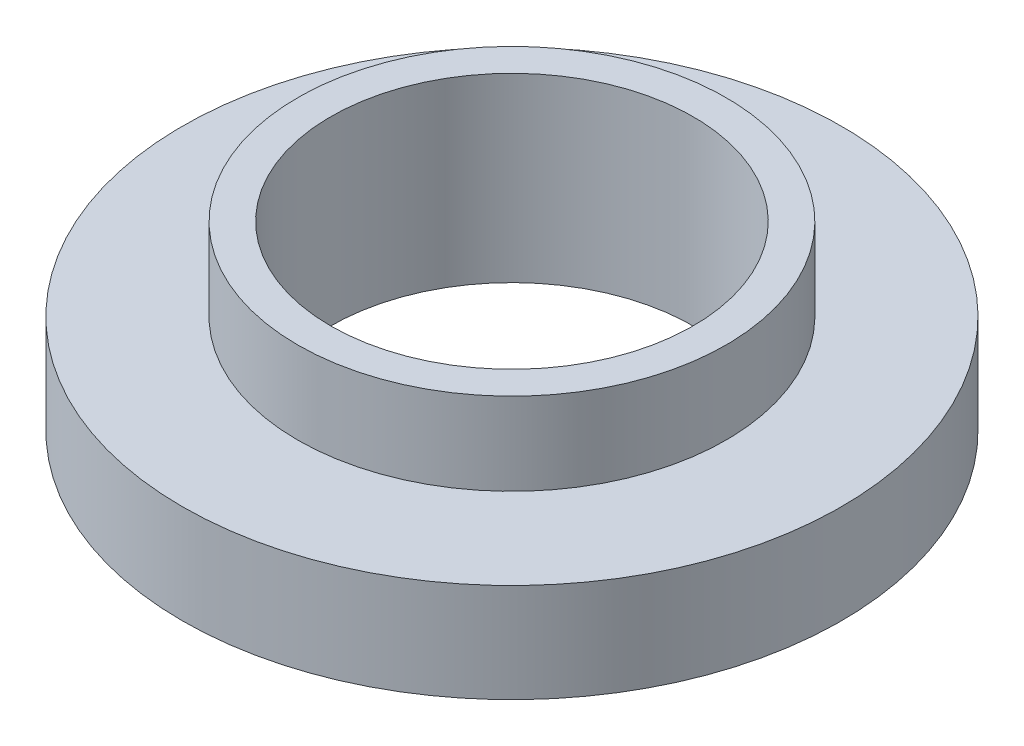
from build123d import *

# Parameters (mm, degrees)
SKETCH_1_R             = 20
SKETCH_1_R_2           = 11
EXTRUDE_1_DEPTH        = 6
SKETCH_2_R             = 13
SKETCH_2_R_2           = 11
EXTRUDE_2_DEPTH        = 5
HOLE_WIZARD_M3_1_D     = 2.5
HOLE_WIZARD_M3_1_DEPTH = 5
HOLE_WIZARD_M3_1_TIP   = 0.751075774


with BuildPart() as part:
    # 草图1 → 凸台-拉伸1 (new body)
    with BuildSketch(Plane(origin=(0, 0, 0), x_dir=(1, 0, 0), z_dir=(0, 1, 0))):
        with Locations(Location((0, 0, 0), (0, 0, 270))):
            Circle(SKETCH_1_R)
        with Locations(Location((0, 0, 0), (0, 0, 270))):
            Circle(SKETCH_1_R_2, mode=Mode.SUBTRACT)
    extrude(amount=EXTRUDE_1_DEPTH)

    # 草图2 → 凸台-拉伸2 (add)
    with BuildSketch(Plane(origin=(0, 6, 0), x_dir=(1, 0, 0), z_dir=(0, 1, 0))):
        with Locations(Location((0, 0, 0), (0, 0, 270))):
            Circle(SKETCH_2_R)
        with Locations(Location((0, 0, 0), (0, 0, 270))):
            Circle(SKETCH_2_R_2, mode=Mode.SUBTRACT)
    extrude(amount=EXTRUDE_2_DEPTH)

    # M3 螺纹孔1
    with Locations(Plane(origin=(0, 0, 0), x_dir=(-1, 0, 0), z_dir=(0, -1, 0))):
        with Locations((-14, 0), (0, -14), (14, 0), (0, 14)):
            Hole(HOLE_WIZARD_M3_1_D / 2, depth=HOLE_WIZARD_M3_1_DEPTH)
            with Locations((0, 0, -(HOLE_WIZARD_M3_1_DEPTH + HOLE_WIZARD_M3_1_TIP / 2))):  # 118° drill point
                Cone(0, HOLE_WIZARD_M3_1_D / 2, HOLE_WIZARD_M3_1_TIP, mode=Mode.SUBTRACT)


solid = part.part
